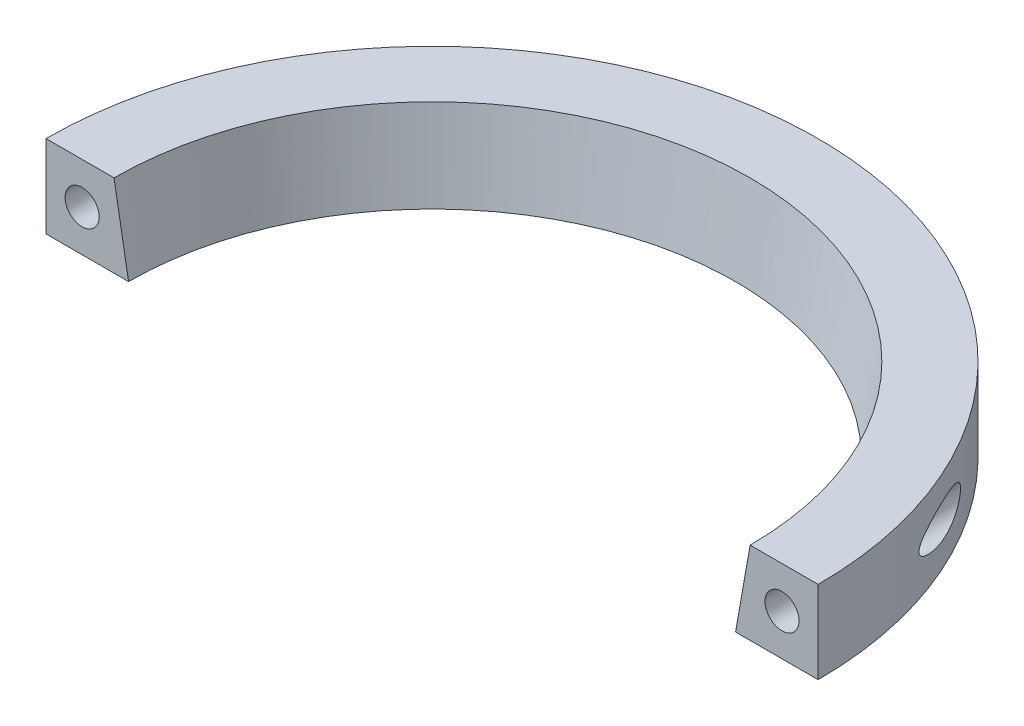
from build123d import *

# Parameters (mm, degrees)
CUT_EXTRUDE3_DEPTH      = 54.524985754
CUT_EXTRUDE3_DEPTH_BACK = 54.524985754
SKETCH5_W               = 145.272182815
SKETCH5_H               = 50.443132161
M4X0_7_TAPPED_HOLE2_D   = 3.3


with BuildPart() as part:
    # Sketch3 → Revolve1 (revolve)
    with BuildSketch(Plane.XY, mode=Mode.PRIVATE) as revolve1_sk:
        Polygon((-30.810615846, 8.21), (-37.4, 8.21), (-37.4, 0.21), (-29.4, 0.21), align=None)
    revolve(revolve1_sk.sketch.rotate(Axis((0, 0, 0), (0, 1, 0)), 270), axis=Axis((0, 0, 0), (0, 1, 0)))

    # Sketch5 → Cut-Extrude3 (cut, two sides: drawn at the far end of the back side and taken through both)
    with BuildSketch(Plane(origin=(0, 0, 0), x_dir=(1, 0, 0), z_dir=(0, 1, 0)).offset(-CUT_EXTRUDE3_DEPTH_BACK)):
        with Locations((35.236091407, -25.221566081)):
            Rectangle(SKETCH5_W, SKETCH5_H)
    extrude(amount=CUT_EXTRUDE3_DEPTH + CUT_EXTRUDE3_DEPTH_BACK, mode=Mode.SUBTRACT)

    # M4x0.7 Tapped Hole2 (through all)
    with Locations(Plane.XY):
        with Locations((-33.9, 4.21), (33.9, 4.21)):
            Hole(M4X0_7_TAPPED_HOLE2_D / 2)


solid = part.part
